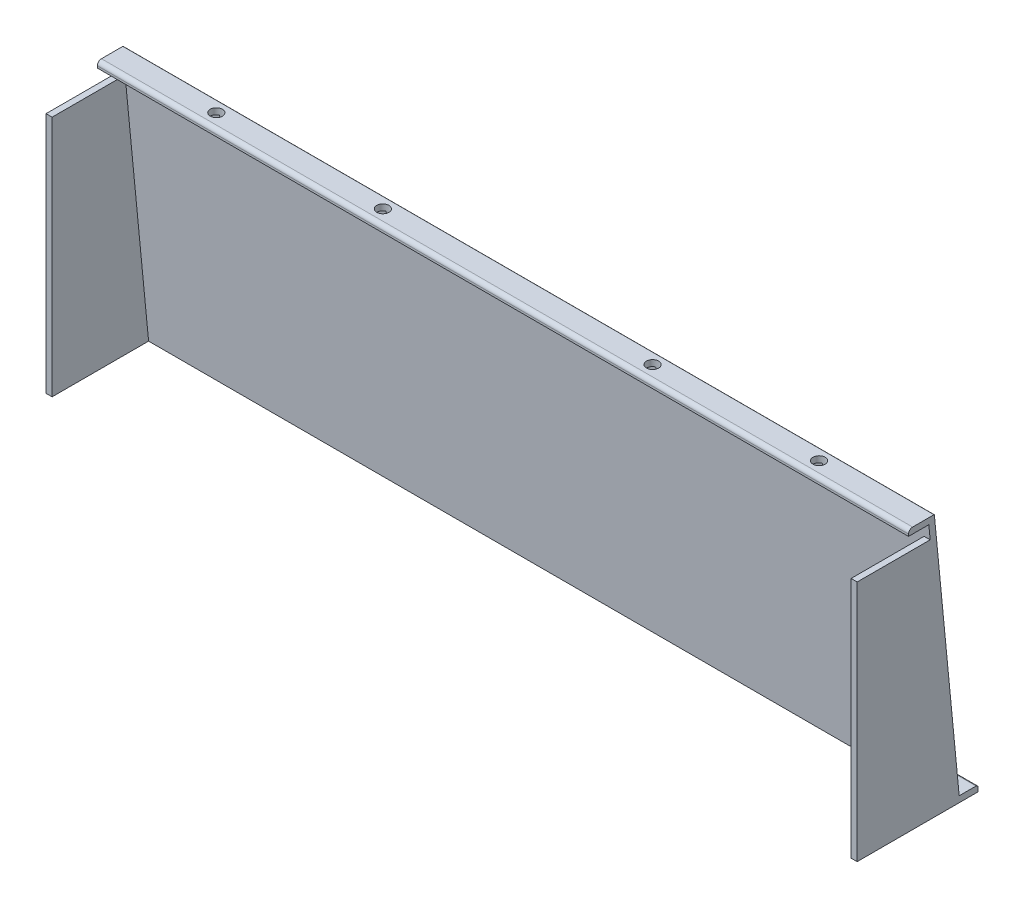
from build123d import *

# Parameters (mm, degrees)
EXTRUDE_1_DEPTH     = 165
SKETCH_2_R          = 1.5
CUT_EXTRUDE_2_DEPTH = 66
EXTRUDE_2_DEPTH     = 1.5
EXTRUDE_START       = 17.5
EXTRUDE_3_DEPTH     = 17.5
EXTRUDE_4_DEPTH     = 1.5
CUT_EXTRUDE_3_DEPTH = 1.5


with BuildPart() as part:
    # 草图1 → 凸台-拉伸1 (new body)
    with BuildSketch(Plane(origin=(0, 0, 0), x_dir=(0, 0, -1), z_dir=(1, 0, 0))):
        with BuildLine():
            Line((0, 4.49026118), (5.69, -54.13973882))
            Line((5.69, -54.13973882), (6.125751322, -58.62973882))
            Line((6.125751322, -58.62973882), (12.125751322, -58.62973882))
            Line((12.125751322, -58.62973882), (12.125751322, -57.62973882))
            ThreePointArc((12.125751322, -57.62973882), (11.979304712, -57.27618543), (11.625751322, -57.12973882))
            Line((11.625751322, -57.12973882), (7.487224752, -57.12973882))
            Line((7.487224752, -57.12973882), (7.05147343, -52.63973882))
            Line((7.05147343, -52.63973882), (1.393781374, 5.657358767))
            Line((1.393781374, 5.657358767), (1.370240908, 5.899920726))
            ThreePointArc((1.370240908, 5.899920726), (1.337917334, 5.964308309), (1.270708535, 5.99026118))
            Line((1.270708535, 5.99026118), (-4, 5.99026118))
            ThreePointArc((-4, 5.99026118), (-4.707106781, 5.697367961), (-5, 4.99026118))
            Line((-5, 4.99026118), (-5, 4.49026118))
            Line((-5, 4.49026118), (0, 4.49026118))
        make_face()
    extrude(amount=EXTRUDE_1_DEPTH)

    # 草图2 → 切除-拉伸2 (cut)
    with BuildSketch(Plane(origin=(0, 5.99026118, 0), x_dir=(1, 0, 0), z_dir=(0, 1, 0))):
        with Locations(Location((156.807985478, -1.364645732, 0), (0, 0, 270))):
            Circle(SKETCH_2_R)
        with Locations(Location((115.749974851, -1.364645732, 0), (0, 0, 270))):
            Circle(SKETCH_2_R)
        with Locations(Location((49.250025149, -1.364645732, 0), (0, 0, 65.47273381))):
            Circle(SKETCH_2_R)
        with Locations(Location((8.192014522, -1.364645732, 0), (0, 0, 65.47273381))):
            Circle(SKETCH_2_R)
        with Locations(Location((8.192014522, 9.011696347, 0), (0, 0, 270))):
            Circle(SKETCH_2_R)
        with Locations(Location((156.807985478, 9.011696347, 0), (0, 0, 270))):
            Circle(SKETCH_2_R)
        with Locations(Location((115.749974851, 9.011696347, 0), (0, 0, 270))):
            Circle(SKETCH_2_R)
        with Locations(Location((49.250025149, 9.011696347, 0), (0, 0, 270))):
            Circle(SKETCH_2_R)
    extrude(amount=-CUT_EXTRUDE_2_DEPTH, mode=Mode.SUBTRACT)

    # 草图3 → 凸台-拉伸2 (add)
    with BuildSketch(Plane(origin=(165, 0, 0), x_dir=(0, 0, -1), z_dir=(1, 0, 0))):
        Polygon((0.32961608, 1.093883189), (-17.67038392, 1.093883189), (-17.67038392, -58.62973882), (6.125751322, -58.62973882), align=None)
    extrude(amount=-EXTRUDE_2_DEPTH)

    # 草图5 → 凸台-拉伸3 (add)
    with BuildSketch(Plane.ZY.offset(EXTRUDE_START)):
        with BuildLine():
            Line((4, 5.99026118), (-1.270708535, 5.99026118))
            ThreePointArc((-1.270708535, 5.99026118), (-1.337917334, 5.964308309), (-1.370240908, 5.899920726))
            Line((-1.370240908, 5.899920726), (-7.487224752, -57.12973882))
            Line((-7.487224752, -57.12973882), (-11.625751322, -57.12973882))
            ThreePointArc((-11.625751322, -57.12973882), (-11.979304712, -57.27618543), (-12.125751322, -57.62973882))
            Line((-12.125751322, -57.62973882), (-12.125751322, -58.62973882))
            Line((-12.125751322, -58.62973882), (-6.125751322, -58.62973882))
            Line((-6.125751322, -58.62973882), (0, 4.49026118))
            Line((0, 4.49026118), (5, 4.49026118))
            Line((5, 4.49026118), (5, 4.99026118))
            ThreePointArc((5, 4.99026118), (4.707106781, 5.697367961), (4, 5.99026118))
        make_face()
    extrude_3 = extrude(amount=-EXTRUDE_3_DEPTH)

    # 镜向2: 凸台-拉伸3 across plane
    add(extrude_3.mirror(Plane(origin=(82.5, 0, 0), x_dir=(0, 0, 1), z_dir=(1, 0, 0))))

    # 草图6 → 凸台-拉伸4 (add)
    with BuildSketch(Plane(origin=(182.5, 0, 0), x_dir=(0, 0, -1), z_dir=(1, 0, 0))):
        Polygon((0.32961608, 1.093883189), (-17.67038392, 1.093883189), (-17.67038392, -58.62973882), (6.125751322, -58.62973882), align=None)
    extrude_4 = extrude(amount=-EXTRUDE_4_DEPTH)

    # 草图7 → 切除-拉伸3 (cut)
    with BuildSketch(Plane(origin=(165, 0, 0), x_dir=(0, 0, -1), z_dir=(1, 0, 0))):
        Polygon((0.32961608, 1.093883189), (6.382938613, -61.279807515), (-18.871026255, -61.279807515), (-18.871026255, 1.093883189), align=None)
    extrude(amount=-CUT_EXTRUDE_3_DEPTH, mode=Mode.SUBTRACT)

    # 镜向4: 凸台-拉伸4 across plane
    add(extrude_4.mirror(Plane(origin=(82.5, 0, 0), x_dir=(0, 0, 1), z_dir=(1, 0, 0))))


solid = part.part
